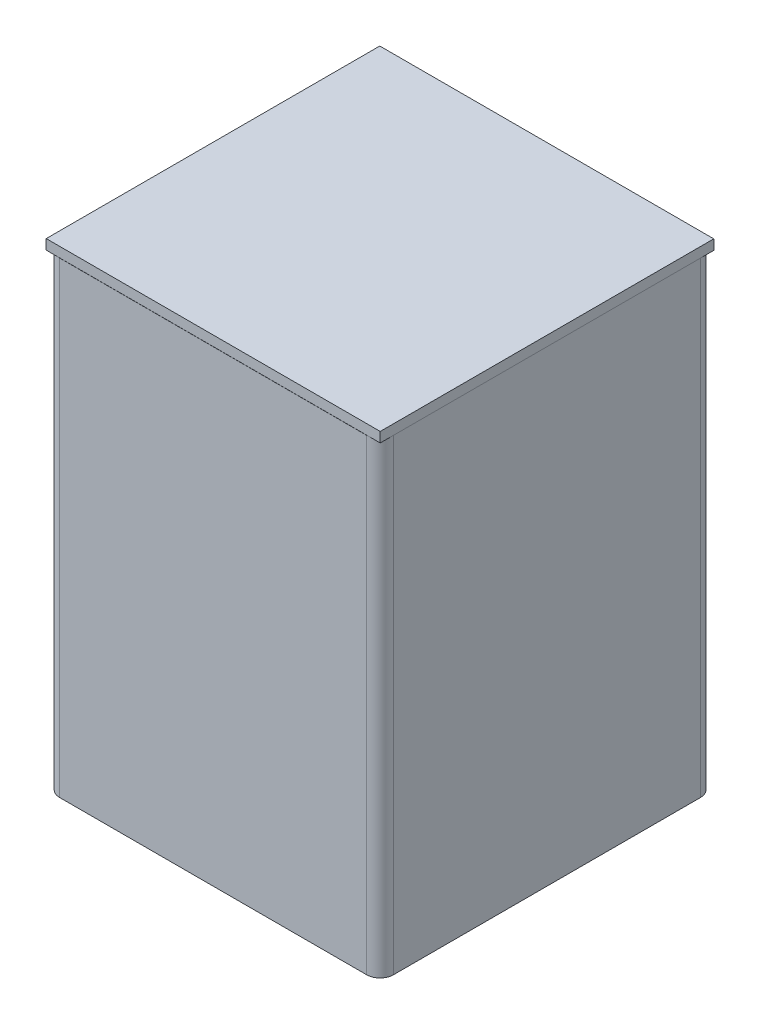
from build123d import *

# Parameters (mm, degrees)
SKETCH10_W          = 127
SKETCH10_H          = 127
BOSS_EXTRUDE1_DEPTH = 177.8
SKETCH11_W          = 119.38
SKETCH11_H          = 119.38
CUT_EXTRUDE6_DEPTH  = 173.99
FILLET1_R           = 5.08
SKETCH13_W          = 116.84
SKETCH13_H          = 116.84
BOSS_EXTRUDE2_DEPTH = 12.7
SKETCH15_W          = 127.11314245
SKETCH15_H          = 126.94044737
BOSS_EXTRUDE4_DEPTH = 3.81


with BuildPart() as part:
    # Sketch10 → Boss-Extrude1 (new body)
    with BuildSketch(Plane(origin=(0, 0, 0), x_dir=(1, 0, 0), z_dir=(0, 1, 0))):
        with Locations((-4.479552988, -44.101426274)):
            Rectangle(SKETCH10_W, SKETCH10_H)
    extrude(amount=BOSS_EXTRUDE1_DEPTH)

    # Sketch11 → Cut-Extrude6 (cut)
    with BuildSketch(Plane(origin=(0, 177.8, 0), x_dir=(1, 0, 0), z_dir=(0, 1, 0))):
        with Locations((-4.479552988, -44.101426274)):
            Rectangle(SKETCH11_W, SKETCH11_H)
    extrude(amount=-CUT_EXTRUDE6_DEPTH, mode=Mode.SUBTRACT)

    # Fillet1
    fillet1_edges = [part.edges().sort_by_distance(p)[0] for p in [
        (-67.979552988, 88.9, -19.398573726),
        (59.020447012, 88.9, -19.398573726),
        (59.020447012, 88.9, 107.601426274),
        (-67.979552988, 88.9, 107.601426274),
    ]]
    fillet(fillet1_edges, radius=FILLET1_R)


with BuildPart() as body_2:
    # Sketch13 → Boss-Extrude2 (new body)
    with BuildSketch(Plane(origin=(0, 177.8, 0), x_dir=(1, 0, 0), z_dir=(0, 1, 0))):
        with Locations((-4.479552988, -44.101426274)):
            Rectangle(SKETCH13_W, SKETCH13_H)
    extrude(amount=-BOSS_EXTRUDE2_DEPTH)


with BuildPart() as body_3:
    # Sketch15 → Boss-Extrude4 (new body)
    with BuildSketch(Plane(origin=(0, 177.8, 0), x_dir=(1, 0, 0), z_dir=(0, 1, 0))):
        with Locations((-4.536124213, -44.071649959)):
            Rectangle(SKETCH15_W, SKETCH15_H)
    extrude(amount=BOSS_EXTRUDE4_DEPTH)

    # Combine1: union body 2
    add(body_2.part)


solid = Compound([part.part, body_3.part])
